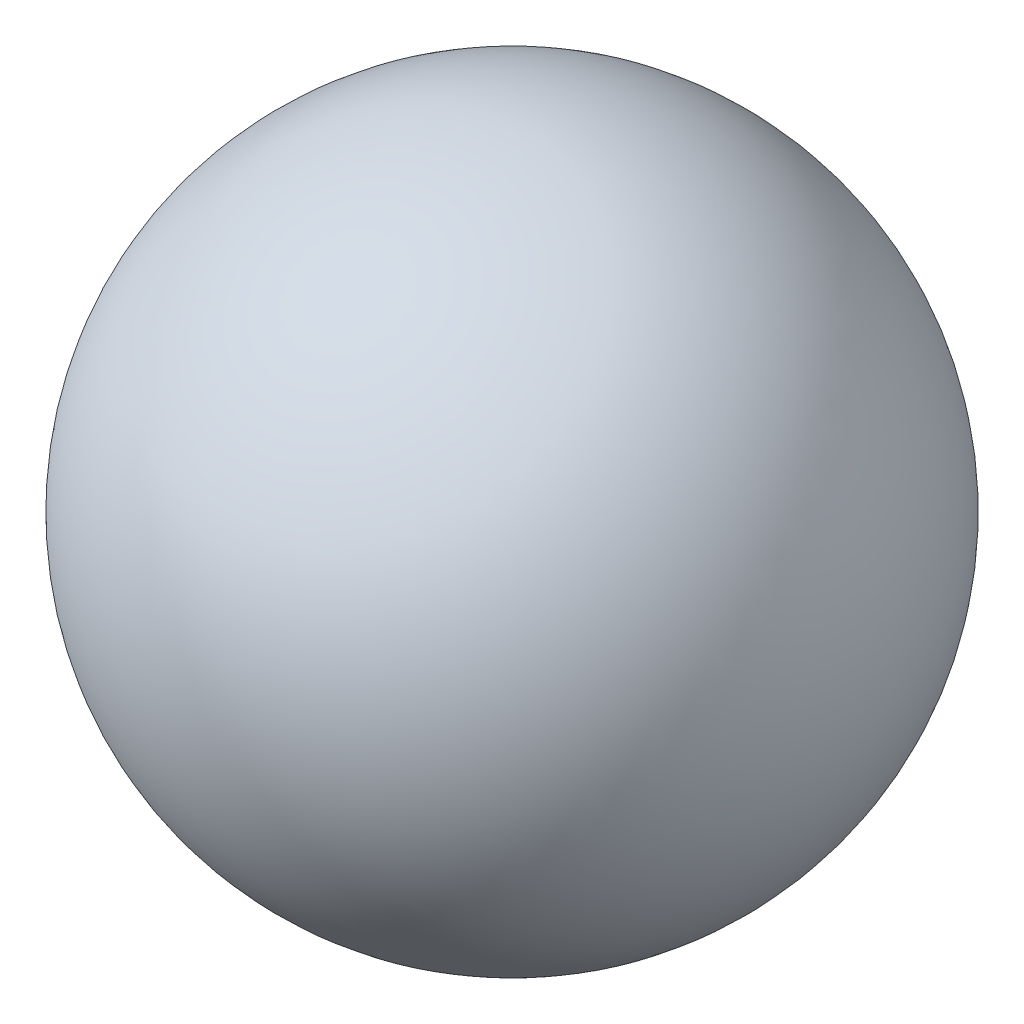
from build123d import *


with BuildPart() as part:
    # Croquis1 → Revolución3 (revolve)
    with BuildSketch(Plane.XY):
        with BuildLine():
            Line((0, 25.4), (0, -25.4))
            ThreePointArc((0, -25.4), (25.4, 0), (0, 25.4))
        make_face()
    revolve(axis=Axis((0, 15.83961802, 0), (0, -1, 0)))


solid = part.part
